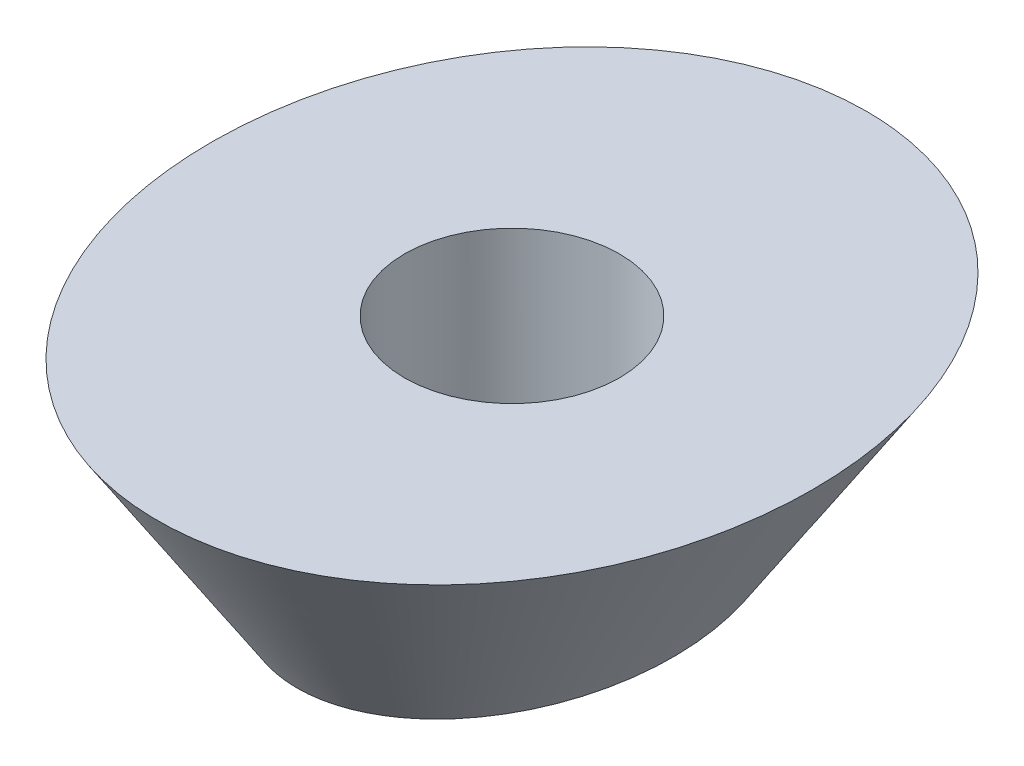
from build123d import *

# Parameters (mm, degrees)
SKETCH1_RX          = 4
SKETCH1_RY          = 3
BOSS_EXTRUDE1_DEPTH = 4
BOSS_EXTRUDE1_TAPER = -33
SKETCH2_R           = 2
CUT_EXTRUDE1_DEPTH  = 10


with BuildPart() as part:
    # Sketch1 → Boss-Extrude1 (new body)
    with BuildSketch(Plane(origin=(0, 0, 0), x_dir=(1, 0, 0), z_dir=(0, 1, 0))):
        with Locations(Location((0, 0), (0, 0, 90))):
            Ellipse(SKETCH1_RX, SKETCH1_RY)
    extrude(amount=BOSS_EXTRUDE1_DEPTH, taper=BOSS_EXTRUDE1_TAPER)

    # Sketch2 → Cut-Extrude1 (cut)
    with BuildSketch(Plane.XZ):
        with Locations(Location((0, 0, 0), (0, 0, 270))):
            Circle(SKETCH2_R)
    extrude(amount=-CUT_EXTRUDE1_DEPTH, mode=Mode.SUBTRACT)


solid = part.part
